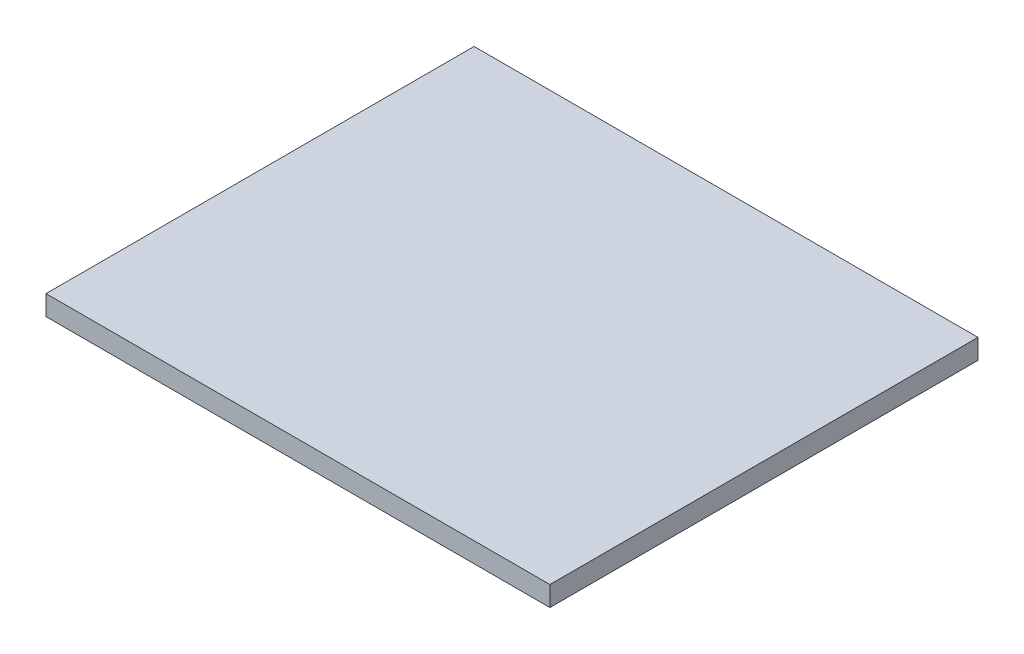
from build123d import *

# Parameters (mm, degrees)
SKETCH1_W           = 75.8
SKETCH1_H           = 64.4
BOSS_EXTRUDE1_DEPTH = 3


with BuildPart() as part:
    # Sketch1 → Boss-Extrude1 (new body)
    with BuildSketch(Plane(origin=(0, 0, 0), x_dir=(1, 0, 0), z_dir=(0, 1, 0))):
        with Locations((37.9, -32.2)):
            Rectangle(SKETCH1_W, SKETCH1_H)
    extrude(amount=BOSS_EXTRUDE1_DEPTH)


solid = part.part
